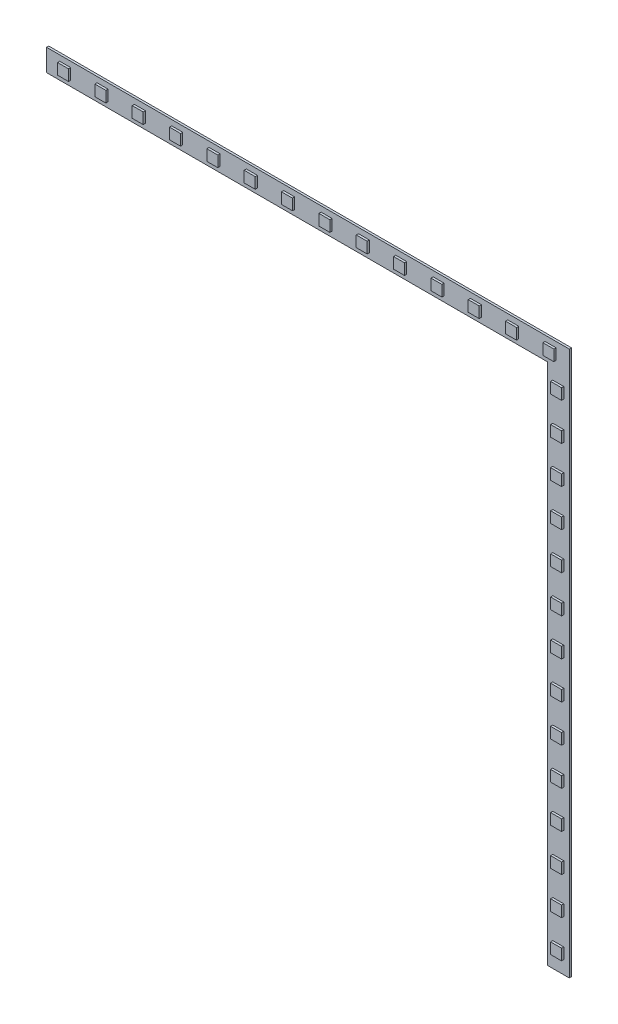
from build123d import *

# Parameters (mm, degrees)
EXTRUDE_1_DEPTH = 1
SKETCH_2_W      = 5
SKETCH_2_H      = 5
EXTRUDE_2_DEPTH = 1


with BuildPart() as part:
    # 草圖1 → 填料-伸長1 (new body)
    with BuildSketch(Plane.XY):
        Polygon((0, 0), (238, 0), (238, -10), (238, -248), (228, -248), (228, -10), (0, -10), align=None)
    extrude(amount=EXTRUDE_1_DEPTH)

    # 草圖2 → 填料-伸長2 (add)
    with BuildSketch(Plane.XY.offset(1)):
        with Locations((25.5, -5)):
            Rectangle(SKETCH_2_W, SKETCH_2_H)
        with Locations((8.5, -5)):
            Rectangle(SKETCH_2_W, SKETCH_2_H)
        with Locations((42.5, -5)):
            Rectangle(SKETCH_2_W, SKETCH_2_H)
        with Locations((59.5, -5)):
            Rectangle(SKETCH_2_W, SKETCH_2_H)
        with Locations((76.5, -5)):
            Rectangle(SKETCH_2_W, SKETCH_2_H)
        with Locations((93.5, -5)):
            Rectangle(SKETCH_2_W, SKETCH_2_H)
        with Locations((110.5, -5)):
            Rectangle(SKETCH_2_W, SKETCH_2_H)
        with Locations((127.5, -5)):
            Rectangle(SKETCH_2_W, SKETCH_2_H)
        with Locations((144.5, -5)):
            Rectangle(SKETCH_2_W, SKETCH_2_H)
        with Locations((161.5, -5)):
            Rectangle(SKETCH_2_W, SKETCH_2_H)
        with Locations((178.5, -5)):
            Rectangle(SKETCH_2_W, SKETCH_2_H)
        with Locations((195.5, -5)):
            Rectangle(SKETCH_2_W, SKETCH_2_H)
        with Locations((212.5, -5)):
            Rectangle(SKETCH_2_W, SKETCH_2_H)
        with Locations((229.5, -5)):
            Rectangle(SKETCH_2_W, SKETCH_2_H)
        with Locations((233, -222.5)):
            Rectangle(SKETCH_2_W, SKETCH_2_H)
        with Locations((233, -239.5)):
            Rectangle(SKETCH_2_W, SKETCH_2_H)
        with Locations((233, -205.5)):
            Rectangle(SKETCH_2_W, SKETCH_2_H)
        with Locations((233, -188.5)):
            Rectangle(SKETCH_2_W, SKETCH_2_H)
        with Locations((233, -171.5)):
            Rectangle(SKETCH_2_W, SKETCH_2_H)
        with Locations((233, -154.5)):
            Rectangle(SKETCH_2_W, SKETCH_2_H)
        with Locations((233, -137.5)):
            Rectangle(SKETCH_2_W, SKETCH_2_H)
        with Locations((233, -120.5)):
            Rectangle(SKETCH_2_W, SKETCH_2_H)
        with Locations((233, -103.5)):
            Rectangle(SKETCH_2_W, SKETCH_2_H)
        with Locations((233, -86.5)):
            Rectangle(SKETCH_2_W, SKETCH_2_H)
        with Locations((233, -69.5)):
            Rectangle(SKETCH_2_W, SKETCH_2_H)
        with Locations((233, -52.5)):
            Rectangle(SKETCH_2_W, SKETCH_2_H)
        with Locations((233, -35.5)):
            Rectangle(SKETCH_2_W, SKETCH_2_H)
        with Locations((233, -18.5)):
            Rectangle(SKETCH_2_W, SKETCH_2_H)
    extrude(amount=EXTRUDE_2_DEPTH)


solid = part.part
